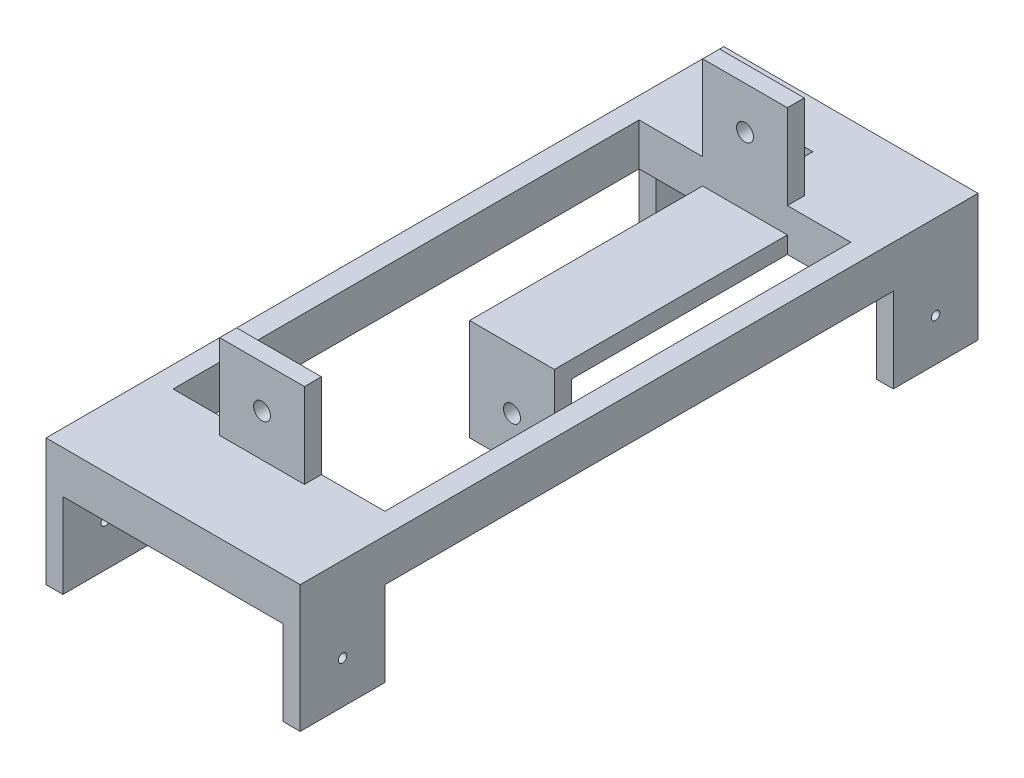
from build123d import *

# Parameters (mm, degrees)
SKETCH1_W                = 30
SKETCH1_H                = 80
BOSS_EXTRUDE1_DEPTH      = 5
SKETCH2_W                = 10
SKETCH2_H                = 10
BOSS_EXTRUDE2_DEPTH      = 30
CUT_EXTRUDE1_DEPTH       = 51.990195136
CUT_EXTRUDE1_DEPTH_BACK  = 51.990195136
SKETCH3_R                = 0.5
CUT_EXTRUDE2_DEPTH       = 46.276925691
CUT_EXTRUDE2_DEPTH_BACK  = 46.276925691
SKETCH4_W                = 25
SKETCH4_H                = 55
CUT_EXTRUDE3_DEPTH       = 83.006097334
CUT_EXTRUDE3_DEPTH_BACK  = 83.006097334
SKETCH5_W                = 26
SKETCH5_H                = 10
SKETCH6_W                = 10
SKETCH6_H                = 10
BOSS_EXTRUDE3_DEPTH      = 80
CUT_EXTRUDE4_DEPTH       = 83.006097334
CUT_EXTRUDE4_DEPTH_BACK  = 83.006097334
SKETCH7_R                = 1
CUT_EXTRUDE5_DEPTH       = 46.82575695
CUT_EXTRUDE5_DEPTH_BACK  = 46.82575695
SKETCH8_W                = 56
SKETCH8_H                = 10
SKETCH9_W                = 10
SKETCH9_H                = 10
CUT_EXTRUDE6_DEPTH       = 10
SKETCH10_W               = 10
SKETCH10_H               = 10
CUT_EXTRUDE7_DEPTH       = 10
SKETCH12_W               = 10
SKETCH12_H               = 2
BOSS_EXTRUDE5_DEPTH      = 10
CUT_EXTRUDE8_DEPTH       = 73.665328734
CUT_EXTRUDE8_DEPTH_BACK  = 73.665328734
SKETCH13_R               = 1
CUT_EXTRUDE11_DEPTH      = 46.276925691
CUT_EXTRUDE11_DEPTH_BACK = 46.276925691
SKETCH15_W               = 2
SKETCH15_H               = 2
SKETCH16_W               = 10
SKETCH16_H               = 10
BOSS_EXTRUDE6_DEPTH      = 30
SKETCH17_W               = 10
SKETCH17_H               = 10
CUT_EXTRUDE12_DEPTH      = 28
CUT_EXTRUDE13_DEPTH      = 48.053161424
CUT_EXTRUDE13_DEPTH_BACK = 48.053161424
SKETCH18_R               = 1
SKETCH20_W               = 10
SKETCH20_H               = 2
BOSS_EXTRUDE7_DEPTH      = 40


with BuildPart() as part:
    # Sketch1 → Boss-Extrude1 (new body)
    with BuildSketch(Plane(origin=(0, 0, 0), x_dir=(1, 0, 0), z_dir=(0, 1, 0))):
        Rectangle(SKETCH1_W, SKETCH1_H)
    extrude(amount=BOSS_EXTRUDE1_DEPTH)

    # Sketch2 → Boss-Extrude2 (add)
    with BuildSketch(Plane(origin=(15, 0, 0), x_dir=(0, 0, -1), z_dir=(1, 0, 0))):
        with Locations((-35, -5)):
            Rectangle(SKETCH2_W, SKETCH2_H)
        with Locations((35, -5)):
            Rectangle(SKETCH2_W, SKETCH2_H)
    extrude(amount=-BOSS_EXTRUDE2_DEPTH)

    # Sketch3 → Cut-Extrude1 (cut, two sides: drawn at the far end of the back side and taken through both)
    with BuildSketch(Plane(origin=(15, 0, 0), x_dir=(0, 0, -1), z_dir=(1, 0, 0)).offset(-CUT_EXTRUDE1_DEPTH_BACK)):
        with Locations((-35, -5)):
            Circle(SKETCH3_R)
        with Locations((35, -5)):
            Circle(SKETCH3_R)
    extrude(amount=CUT_EXTRUDE1_DEPTH + CUT_EXTRUDE1_DEPTH_BACK, mode=Mode.SUBTRACT)

    # Sketch4 → Cut-Extrude2 (cut, two sides: drawn at the far end of the back side and taken through both)
    with BuildSketch(Plane(origin=(0, 5, 0), x_dir=(1, 0, 0), z_dir=(0, 1, 0)).offset(-CUT_EXTRUDE2_DEPTH_BACK)):
        Rectangle(SKETCH4_W, SKETCH4_H)
    extrude(amount=CUT_EXTRUDE2_DEPTH + CUT_EXTRUDE2_DEPTH_BACK, mode=Mode.SUBTRACT)

    # Sketch5 → Cut-Extrude3 (cut, two sides: drawn at the far end of the back side and taken through both)
    with BuildSketch(Plane(origin=(0, 0, -40), x_dir=(-1, 0, 0), z_dir=(0, 0, -1)).offset(-CUT_EXTRUDE3_DEPTH_BACK)):
        with Locations((0, -5)):
            Rectangle(SKETCH5_W, SKETCH5_H)
    extrude(amount=CUT_EXTRUDE3_DEPTH + CUT_EXTRUDE3_DEPTH_BACK, mode=Mode.SUBTRACT)

    # Sketch6 → Boss-Extrude3 (add)
    with BuildSketch(Plane(origin=(0, 0, -40), x_dir=(-1, 0, 0), z_dir=(0, 0, -1))):
        with Locations((0, -5)):
            Rectangle(SKETCH6_W, SKETCH6_H)
    extrude(amount=-BOSS_EXTRUDE3_DEPTH)

    # Sketch7 → Cut-Extrude4 (cut, two sides: drawn at the far end of the back side and taken through both)
    with BuildSketch(Plane(origin=(0, 0, -40), x_dir=(-1, 0, 0), z_dir=(0, 0, -1)).offset(-CUT_EXTRUDE4_DEPTH_BACK)):
        with Locations((0, -5)):
            Circle(SKETCH7_R)
    extrude(amount=CUT_EXTRUDE4_DEPTH + CUT_EXTRUDE4_DEPTH_BACK, mode=Mode.SUBTRACT)

    # Sketch8 → Cut-Extrude5 (cut, two sides: drawn at the far end of the back side and taken through both)
    with BuildSketch(Plane(origin=(5, 0, 0), x_dir=(0, 0, -1), z_dir=(1, 0, 0)).offset(-CUT_EXTRUDE5_DEPTH_BACK)):
        with Locations((0, -5)):
            Rectangle(SKETCH8_W, SKETCH8_H)
    extrude(amount=CUT_EXTRUDE5_DEPTH + CUT_EXTRUDE5_DEPTH_BACK, mode=Mode.SUBTRACT)

    # Sketch9 → Cut-Extrude6 (cut)
    with BuildSketch(Plane.XY.offset(40)):
        with Locations((0, -5)):
            Rectangle(SKETCH9_W, SKETCH9_H)
    extrude(amount=-CUT_EXTRUDE6_DEPTH, mode=Mode.SUBTRACT)

    # Sketch10 → Cut-Extrude7 (cut)
    with BuildSketch(Plane(origin=(0, 0, -40), x_dir=(-1, 0, 0), z_dir=(0, 0, -1))):
        with Locations((0, -5)):
            Rectangle(SKETCH10_W, SKETCH10_H)
    extrude(amount=-CUT_EXTRUDE7_DEPTH, mode=Mode.SUBTRACT)

    # Sketch12 → Boss-Extrude5 (add)
    with BuildSketch(Plane(origin=(0, 5, 0), x_dir=(1, 0, 0), z_dir=(0, 1, 0))):
        with Locations((0, -28.5)):
            Rectangle(SKETCH12_W, SKETCH12_H)
        with Locations((0, 28.5)):
            Rectangle(SKETCH12_W, SKETCH12_H)
    extrude(amount=BOSS_EXTRUDE5_DEPTH)

    # Sketch13 → Cut-Extrude8 (cut, two sides: drawn at the far end of the back side and taken through both)
    with BuildSketch(Plane.XY.offset(29.5).offset(-CUT_EXTRUDE8_DEPTH_BACK)):
        with Locations((0, 10)):
            Circle(SKETCH13_R)
    extrude(amount=CUT_EXTRUDE8_DEPTH + CUT_EXTRUDE8_DEPTH_BACK, mode=Mode.SUBTRACT)

    # Sketch15 → Cut-Extrude11 (cut, two sides: drawn at the far end of the back side and taken through both)
    with BuildSketch(Plane(origin=(0, 5, 0), x_dir=(1, 0, 0), z_dir=(0, 1, 0)).offset(-CUT_EXTRUDE11_DEPTH_BACK)):
        with Locations((0, 33.5)):
            Rectangle(SKETCH15_W, SKETCH15_H)
    extrude(amount=CUT_EXTRUDE11_DEPTH + CUT_EXTRUDE11_DEPTH_BACK, mode=Mode.SUBTRACT)

    # Sketch16 → Boss-Extrude6 (add)
    with BuildSketch(Plane(origin=(0, 0, -30), x_dir=(-1, 0, 0), z_dir=(0, 0, -1))):
        with Locations((0, -5)):
            Rectangle(SKETCH16_W, SKETCH16_H)
    extrude(amount=-BOSS_EXTRUDE6_DEPTH)

    # Sketch17 → Cut-Extrude12 (cut)
    with BuildSketch(Plane(origin=(0, 0, -30), x_dir=(-1, 0, 0), z_dir=(0, 0, -1))):
        with Locations((0, -5)):
            Rectangle(SKETCH17_W, SKETCH17_H)
    extrude(amount=-CUT_EXTRUDE12_DEPTH, mode=Mode.SUBTRACT)


with BuildPart() as cut_extrude12_piece_1:
    # of the separate pieces the step leaves, piece 1, a body of its own (cut_extrude12_pieces)
    add(part.part.solids().sort_by_distance((-13, -10, -40))[0])



with BuildPart() as cut_extrude12_piece_2:
    # of the separate pieces the step leaves, piece 2, a body of its own (cut_extrude12_pieces)
    add(part.part.solids().sort_by_distance((-5, 0, -2))[0])

    # Sketch18 → Cut-Extrude13 (cut, two sides: drawn at the far end of the back side and taken through both)
    with BuildSketch(Plane(origin=(0, 0, -2), x_dir=(-1, 0, 0), z_dir=(0, 0, -1)).offset(-CUT_EXTRUDE13_DEPTH_BACK)):
        with Locations((0, -5)):
            Circle(SKETCH18_R)
    extrude(amount=CUT_EXTRUDE13_DEPTH + CUT_EXTRUDE13_DEPTH_BACK, mode=Mode.SUBTRACT)


with BuildPart() as cut_extrude12_piece_1_1:
    add(cut_extrude12_piece_1.part)

    add(cut_extrude12_piece_2.part)  # Boss-Extrude7 merges Cut-Extrude12 piece 2
    # Sketch20 → Boss-Extrude7 (add)
    with BuildSketch(Plane(origin=(0, 0, -40), x_dir=(-1, 0, 0), z_dir=(0, 0, -1))):
        with Locations((0, 1)):
            Rectangle(SKETCH20_W, SKETCH20_H)
    extrude(amount=-BOSS_EXTRUDE7_DEPTH)


solid = cut_extrude12_piece_1_1.part
